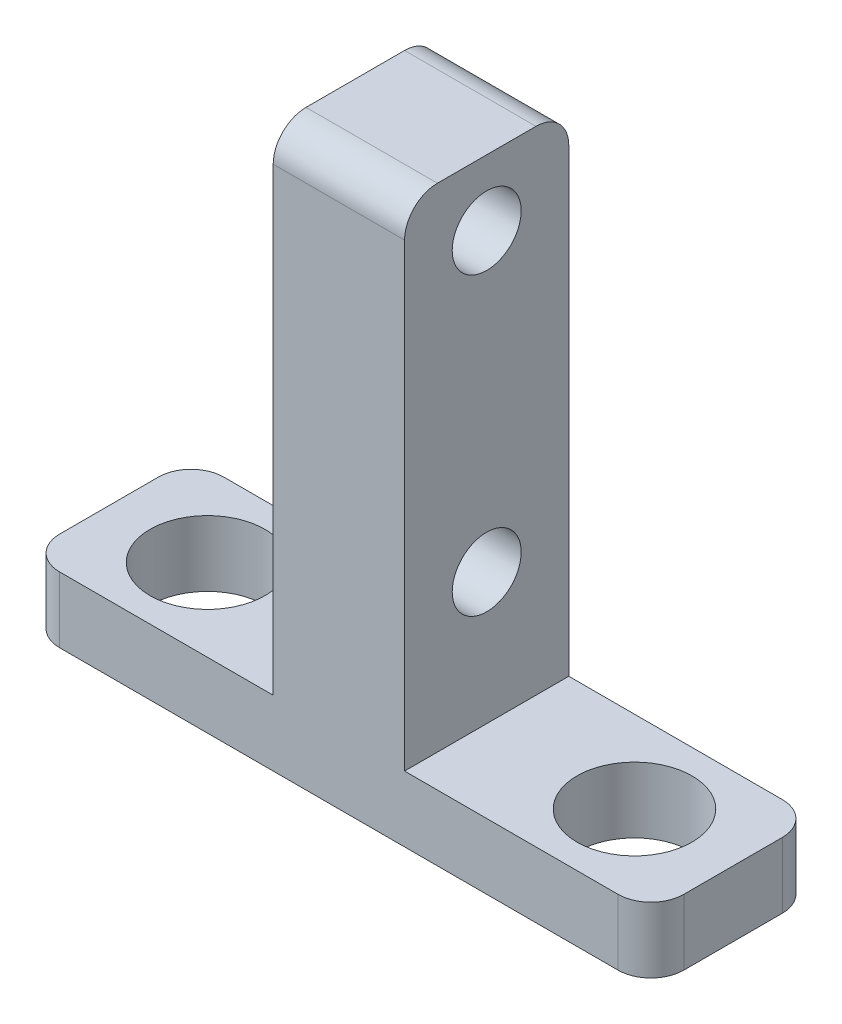
from build123d import *

# Parameters (mm, degrees)
EXTRUDE_1_DEPTH     = 2
SKETCH_2_W          = 4
SKETCH_2_H          = 5
EXTRUDE_2_DEPTH     = 15
SKETCH_3_R          = 1.05
CUT_EXTRUDE_1_DEPTH = 12
SKETCH_5_R          = 1.75
CUT_EXTRUDE_2_DEPTH = 12
FILLET_1_R          = 1
FILLET_2_R          = 1


with BuildPart() as part:
    # 草图1 → 凸台-拉伸1 (new body)
    with BuildSketch(Plane(origin=(0, 0, 0), x_dir=(1, 0, 0), z_dir=(0, 1, 0))):
        Polygon((0, -5), (13, -5), (16, -5), (16, 0), (13, 0), (0, 0), (-3, 0), (-3, -5), align=None)
    extrude(amount=EXTRUDE_1_DEPTH)

    # 草图2 → 凸台-拉伸2 (add)
    with BuildSketch(Plane(origin=(0, 2, 0), x_dir=(1, 0, 0), z_dir=(0, 1, 0))):
        with Locations((6.5, -2.5)):
            Rectangle(SKETCH_2_W, SKETCH_2_H)
    extrude(amount=EXTRUDE_2_DEPTH)

    # 草图3 → 切除-拉伸1 (cut)
    with BuildSketch(Plane.ZY.offset(-4.5)):
        with Locations((2.5, 15)):
            Circle(SKETCH_3_R)
        with Locations((2.5, 6)):
            Circle(SKETCH_3_R)
    extrude(amount=-CUT_EXTRUDE_1_DEPTH, mode=Mode.SUBTRACT)

    # 草图5 → 切除-拉伸2 (cut)
    with BuildSketch(Plane(origin=(0, 2, 0), x_dir=(1, 0, 0), z_dir=(0, 1, 0))):
        with Locations(Location((0, -2.5, 0), (0, 0, 270))):
            Circle(SKETCH_5_R)
        with Locations(Location((13, -2.5, 0), (0, 0, 270))):
            Circle(SKETCH_5_R)
    extrude(amount=-CUT_EXTRUDE_2_DEPTH, mode=Mode.SUBTRACT)

    # 圆角1
    fillet_1_edges = [part.edges().sort_by_distance(p)[0] for p in [
        (16, 1, 0),
        (16, 1, 5),
        (-3, 1, 5),
        (-3, 1, 0),
    ]]
    fillet(fillet_1_edges, radius=FILLET_1_R)

    # 圆角2
    fillet_2_edges = [part.edges().sort_by_distance(p)[0] for p in [
        (6.5, 17, 0),
        (6.5, 17, 5),
    ]]
    fillet(fillet_2_edges, radius=FILLET_2_R)


solid = part.part
